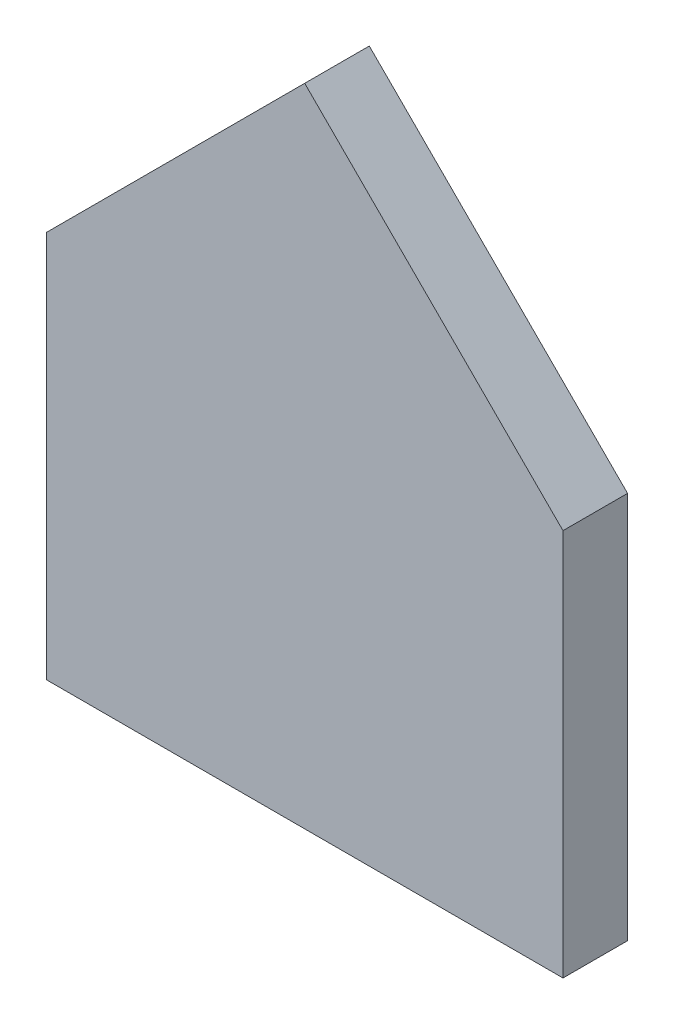
from build123d import *

# Parameters (mm, degrees)
BOSS_EXTRU_1_DEPTH = 10


with BuildPart() as part:
    # Esquisse1 → Boss.-Extru.1 (new body)
    with BuildSketch(Plane.XY):
        Polygon((-40, -50), (-40, 10), (0, 50), (40, 10), (40, -50), align=None)
    extrude(amount=BOSS_EXTRU_1_DEPTH)


solid = part.part
